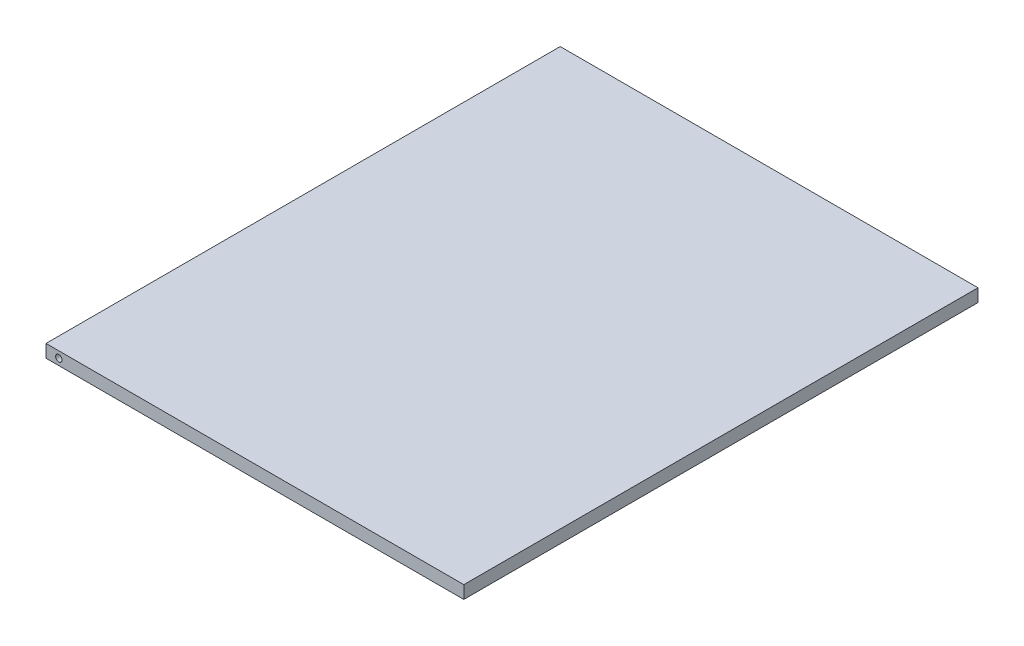
from build123d import *

# Parameters (mm, degrees)
SKETCH1_W           = 65
SKETCH1_H           = 80
BOSS_EXTRUDE1_DEPTH = 2
SKETCH2_R           = 0.5
CUT_EXTRUDE1_DEPTH  = 87.372738755


with BuildPart() as part:
    # Sketch1 → Boss-Extrude1 (new body)
    with BuildSketch(Plane(origin=(0, 0, 0), x_dir=(1, 0, 0), z_dir=(0, 1, 0))):
        Rectangle(SKETCH1_W, SKETCH1_H)
    extrude(amount=BOSS_EXTRUDE1_DEPTH)

    # Sketch2 → Cut-Extrude1 (cut, through all)
    with BuildSketch(Plane.XY.offset(40)):
        with Locations((-30.5, 1)):
            Circle(SKETCH2_R)
    extrude(amount=-CUT_EXTRUDE1_DEPTH, mode=Mode.SUBTRACT)


solid = part.part
